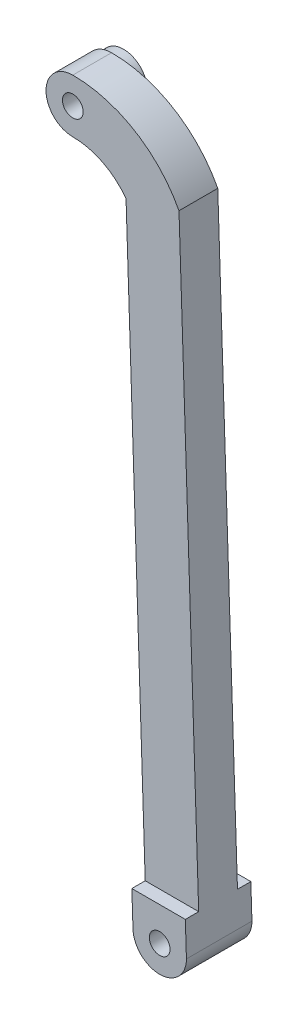
from build123d import *

# Parameters (mm, degrees)
BOSS_EXTRU_1_DEPTH      = 4.9
BOSS_EXTRU_1_DEPTH_BACK = 4.9
ESQUISSE1_R             = 1.55
CUT_EXTRUDE1_START      = -2
CUT_EXTRUDE1_DEPTH      = 2
BOSS_EXTRUDE1_START     = 1.8
SKETCH2_R               = 3.55
SKETCH2_R_2             = 1.55
BOSS_EXTRUDE1_DEPTH     = 1.8


with BuildPart() as part:
    # Esquisse1 → Boss.-Extru.1 (new, two sides: drawn at the far end of the back side and taken through both)
    with BuildSketch(Plane.XY.offset(-BOSS_EXTRU_1_DEPTH_BACK)):
        with BuildLine():
            Line((-7.035134666, 91.99317437), (-4, 0))
            ThreePointArc((-4, 0), (0, -4), (4, 0))
            Line((4, 0), (0.886406153, 94.37122672))
            ThreePointArc((0.886406153, 94.37122672), (-5.711685092, 101.40489844), (-15, 104))
            ThreePointArc((-15, 104), (-19, 100), (-15, 96))
            ThreePointArc((-15, 96), (-10.542037141, 94.941857654), (-7.035134666, 91.99317437))
        make_face()
        Circle(ESQUISSE1_R, mode=Mode.SUBTRACT)
        with Locations((-15, 100)):
            Circle(ESQUISSE1_R, mode=Mode.SUBTRACT)
    extrude(amount=BOSS_EXTRU_1_DEPTH + BOSS_EXTRU_1_DEPTH_BACK)

    # Sketch1 → Cut-Extrude1 (cut)
    with BuildSketch(Plane.XY.offset(4.9).offset(CUT_EXTRUDE1_START)):
        with BuildLine():
            Line((-7.035134666, 91.99317437), (-4.166311888, 5.040817029))
            Line((-4.166311888, 5.040817029), (3.833688112, 5.040817029))
            Line((3.833688112, 5.040817029), (0.886406153, 94.37122672))
            ThreePointArc((0.886406153, 94.37122672), (-5.711685092, 101.40489844), (-15, 104))
            ThreePointArc((-15, 104), (-19, 100), (-15, 96))
            ThreePointArc((-15, 96), (-10.542037141, 94.941857654), (-7.035134666, 91.99317437))
        make_face()
    cut_extrude1 = extrude(amount=CUT_EXTRUDE1_DEPTH, mode=Mode.SUBTRACT)

    # Mirror1: Cut-Extrude1 across plane
    add(cut_extrude1.mirror(Plane.XY), mode=Mode.SUBTRACT)

    # Sketch2 → Boss-Extrude1 (add)
    with BuildSketch(Plane(origin=(0, 0, -2.9), x_dir=(-1, 0, 0), z_dir=(0, 0, -1)).offset(BOSS_EXTRUDE1_START)):
        with Locations((15, 100)):
            Circle(SKETCH2_R)
        with Locations((15, 100)):
            Circle(SKETCH2_R_2, mode=Mode.SUBTRACT)
    extrude(amount=-BOSS_EXTRUDE1_DEPTH)


solid = part.part
